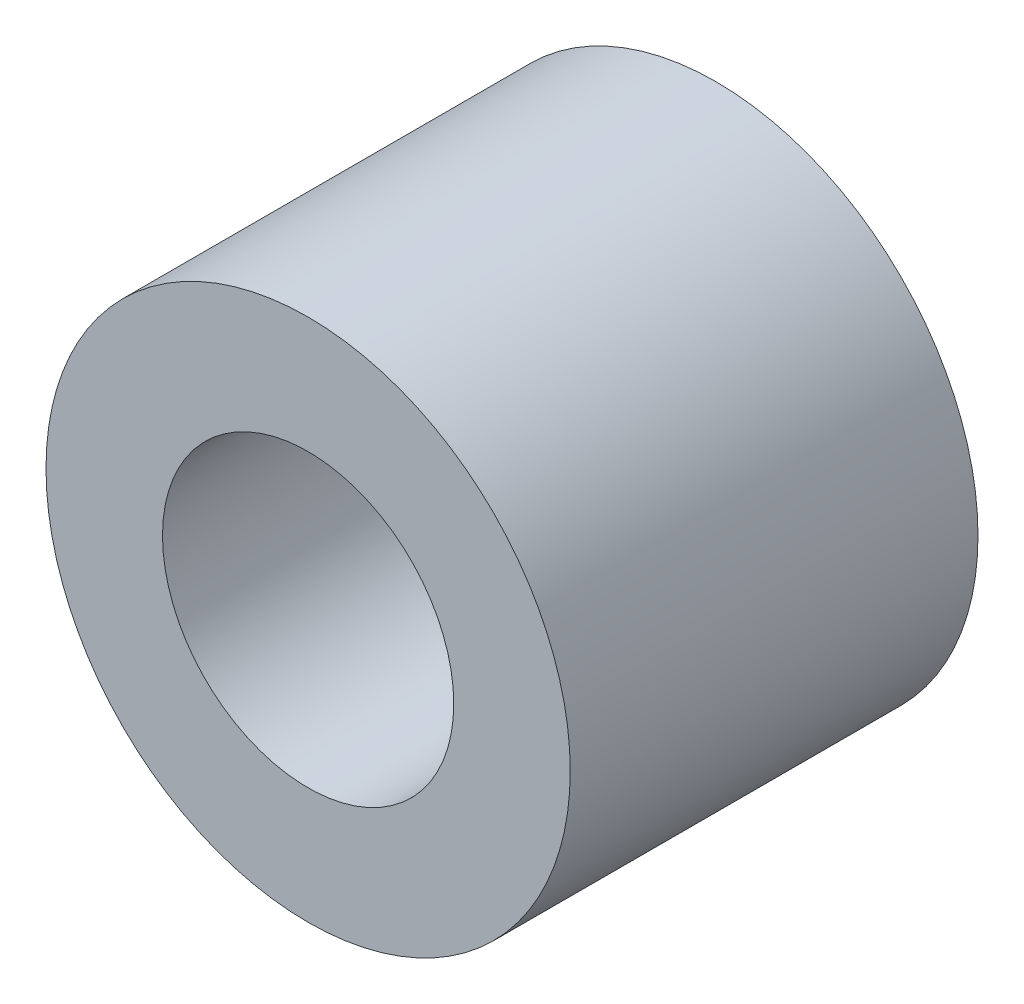
from build123d import *

# Parameters (mm, degrees)
ESBO_O1_R                = 4.5
ESBO_O1_R_2              = 2.5
RESSALTO_EXTRUS_O1_DEPTH = 7


with BuildPart() as part:
    # Esboço1 → Ressalto-extrusão1 (new body)
    with BuildSketch(Plane.XY):
        Circle(ESBO_O1_R)
        Circle(ESBO_O1_R_2, mode=Mode.SUBTRACT)
    extrude(amount=RESSALTO_EXTRUS_O1_DEPTH)


solid = part.part
